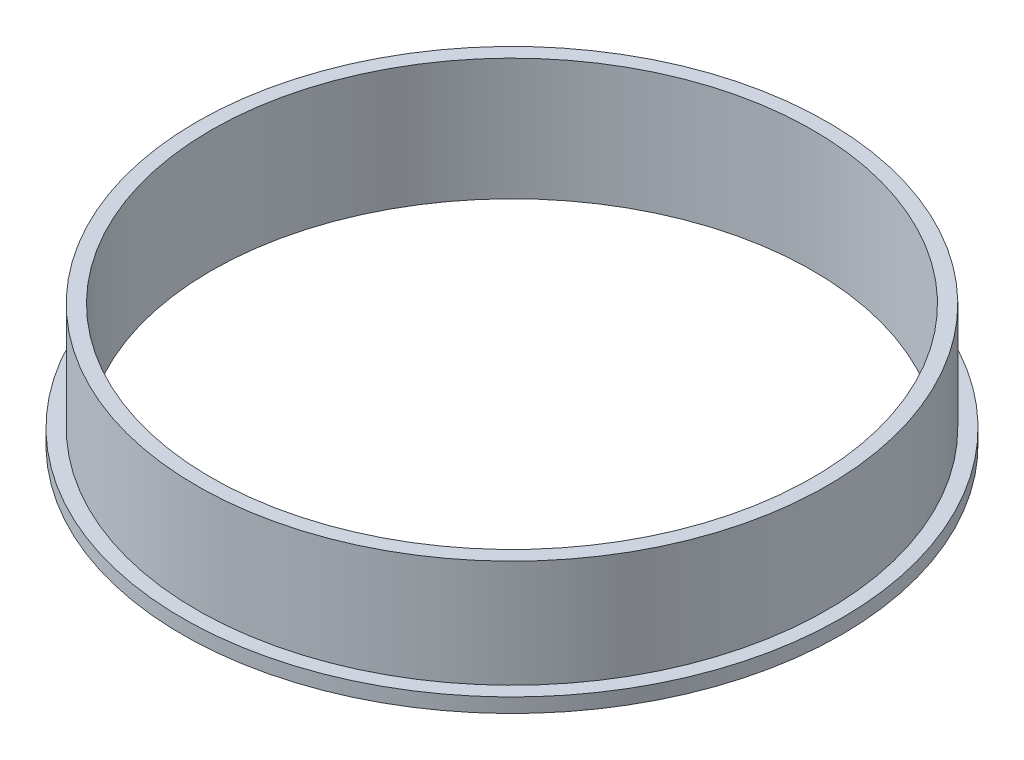
from build123d import *


with BuildPart() as part:
    # Sketch1 → Revolve1 (revolve)
    with BuildSketch(Plane.XY):
        Polygon((-44, 24), (-42, 24), (-42, 7), (-46, 7), (-46, 9), (-44, 9), align=None)
    revolve(axis=Axis((0, 15.855614973, 0), (0, -1, 0)))


solid = part.part
